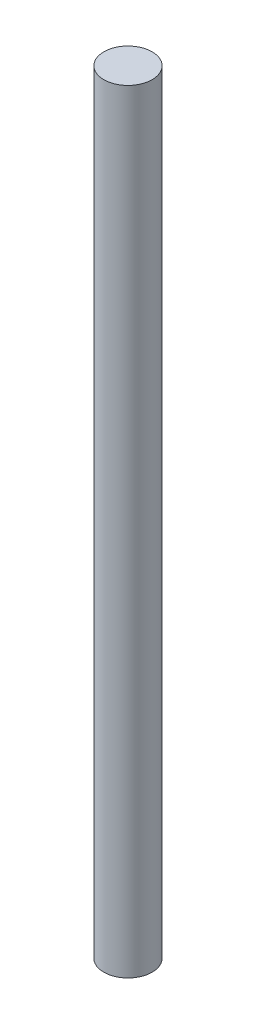
from build123d import *

# Parameters (mm, degrees)
SKETCH2_R           = 2.5
BOSS_EXTRUDE1_DEPTH = 80


with BuildPart() as part:
    # Sketch2 → Boss-Extrude1 (new body)
    with BuildSketch(Plane(origin=(0, 0, 0), x_dir=(1, 0, 0), z_dir=(0, 1, 0))):
        with Locations(Location((0, 0, 0), (0, 0, 270))):
            Circle(SKETCH2_R)
    extrude(amount=BOSS_EXTRUDE1_DEPTH)


solid = part.part
